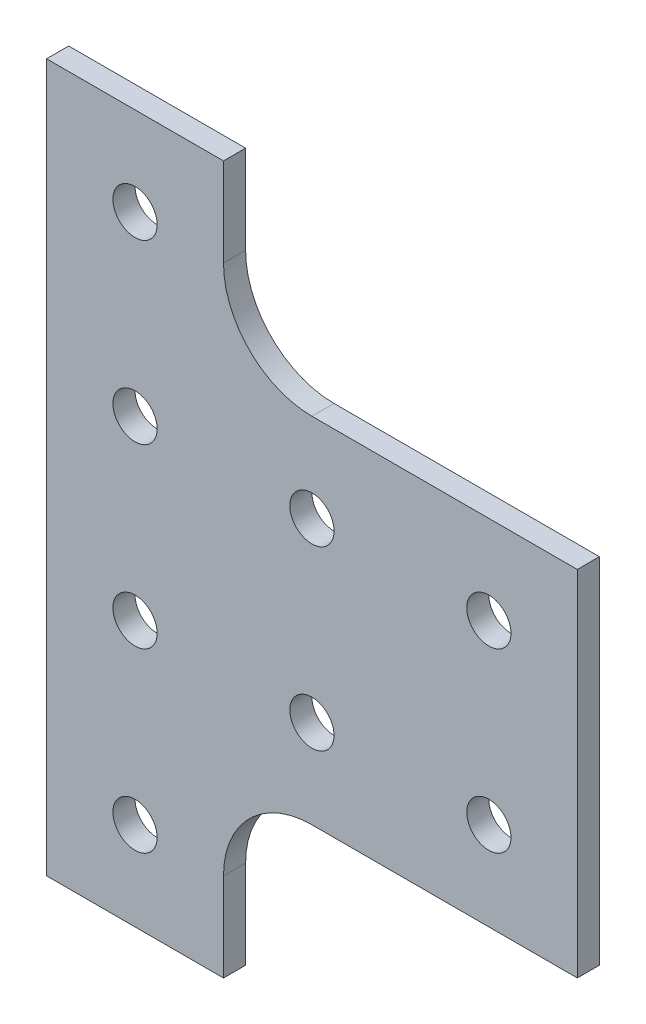
from build123d import *

# Parameters (mm, degrees)
SKETCH1_R           = 3.175
BOSS_EXTRUDE1_DEPTH = 3.175
FILLET1_R           = 12.7


with BuildPart() as part:
    # Sketch1 → Boss-Extrude1 (new body)
    with BuildSketch(Plane.XY):
        Polygon((0, 0), (0, 101.6), (25.4, 101.6), (25.4, 76.2), (76.2, 76.2), (76.2, 25.4), (25.4, 25.4), (25.4, 0), align=None)
        with Locations((12.7, 88.9)):
            Circle(SKETCH1_R, mode=Mode.SUBTRACT)
        with Locations((12.7, 63.5)):
            Circle(SKETCH1_R, mode=Mode.SUBTRACT)
        with Locations((12.7, 38.1)):
            Circle(SKETCH1_R, mode=Mode.SUBTRACT)
        with Locations((12.7, 12.7)):
            Circle(SKETCH1_R, mode=Mode.SUBTRACT)
        with Locations((38.1, 63.5)):
            Circle(SKETCH1_R, mode=Mode.SUBTRACT)
        with Locations((38.1, 38.1)):
            Circle(SKETCH1_R, mode=Mode.SUBTRACT)
        with Locations((63.5, 63.5)):
            Circle(SKETCH1_R, mode=Mode.SUBTRACT)
        with Locations((63.5, 38.1)):
            Circle(SKETCH1_R, mode=Mode.SUBTRACT)
    extrude(amount=BOSS_EXTRUDE1_DEPTH)

    # Fillet1
    fillet1_edges = [part.edges().sort_by_distance(p)[0] for p in [
        (25.4, 76.2, 1.5875),
        (25.4, 25.4, 1.5875),
    ]]
    fillet(fillet1_edges, radius=FILLET1_R)


solid = part.part
